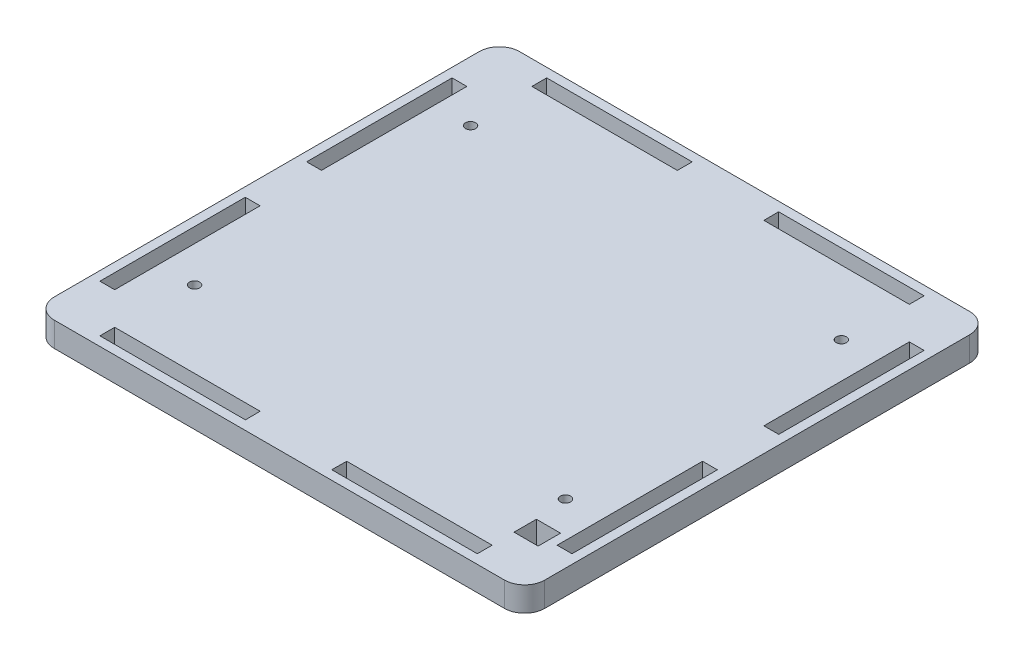
from build123d import *

# Parameters (mm, degrees)
SKETCH1_W           = 108.458
SKETCH1_H           = 102.87
SKETCH1_R           = 1.1303
SKETCH1_W_2         = 3.2766
SKETCH1_H_2         = 32.1564
BOSS_EXTRUDE1_DEPTH = 2.7178
FILLET1_R           = 4.445
SKETCH3_W           = 5.334
SKETCH3_H           = 4.953
CUT_EXTRUDE2_DEPTH  = 75.939238142


with BuildPart() as part:
    # Sketch1 → Boss-Extrude1 (new, symmetric)
    with BuildSketch(Plane(origin=(0, 0, 0), x_dir=(1, 0, 0), z_dir=(0, 1, 0))):
        Rectangle(SKETCH1_W, SKETCH1_H)
        with Locations(Location((-40.9956, -29.1846, 0), (0, 0, 270))):
            Circle(SKETCH1_R, mode=Mode.SUBTRACT)
        with Locations(Location((40.9956, -29.1846, 0), (0, 0, 90))):
            Circle(SKETCH1_R, mode=Mode.SUBTRACT)
        with Locations(Location((-40.9956, 31.8262, 0), (0, 0, 270))):
            Circle(SKETCH1_R, mode=Mode.SUBTRACT)
        with Locations(Location((40.9956, 31.8262, 0), (0, 0, 90))):
            Circle(SKETCH1_R, mode=Mode.SUBTRACT)
        Polygon((41.7322, 46.126399066), (41.7322, 49.403), (9.548058937, 49.403), (9.578119675, 46.126517444), align=None, mode=Mode.SUBTRACT)
        Polygon((-9.578119675, 46.126517444), (-9.548058937, 49.403), (-41.7322, 49.403), (-41.7322, 46.126399066), align=None, mode=Mode.SUBTRACT)
        with Locations((50.5587, -22.86)):
            Rectangle(SKETCH1_W_2, SKETCH1_H_2, mode=Mode.SUBTRACT)
        with Locations((50.5587, 22.86)):
            Rectangle(SKETCH1_W_2, SKETCH1_H_2, mode=Mode.SUBTRACT)
        Polygon((41.7322, -46.126399065), (9.578119675, -46.126517443), (9.548058937, -49.403), (41.7322, -49.403), align=None, mode=Mode.SUBTRACT)
        Polygon((-41.7322, -46.126399065), (-41.7322, -49.403), (-9.548058937, -49.403), (-9.578119675, -46.126517443), align=None, mode=Mode.SUBTRACT)
        with Locations((-50.5587, 22.86)):
            Rectangle(SKETCH1_W_2, SKETCH1_H_2, mode=Mode.SUBTRACT)
        with Locations((-50.5587, -22.86)):
            Rectangle(SKETCH1_W_2, SKETCH1_H_2, mode=Mode.SUBTRACT)
    extrude(amount=BOSS_EXTRUDE1_DEPTH, both=True)

    # Fillet1
    fillet1_edges = [part.edges().sort_by_distance(p)[0] for p in [
        (-54.229, 0, -51.435),
        (54.229, 0, -51.435),
        (54.229, 0, 51.435),
        (-54.229, 0, 51.435),
    ]]
    fillet(fillet1_edges, radius=FILLET1_R)

    # Sketch3 → Cut-Extrude2 (cut, through all)
    with BuildSketch(Plane(origin=(0, 2.7178, 0), x_dir=(1, 0, 0), z_dir=(0, 1, 0))):
        with Locations((44.323, -38.735)):
            Rectangle(SKETCH3_W, SKETCH3_H)
    extrude(amount=-CUT_EXTRUDE2_DEPTH, mode=Mode.SUBTRACT)


solid = part.part
